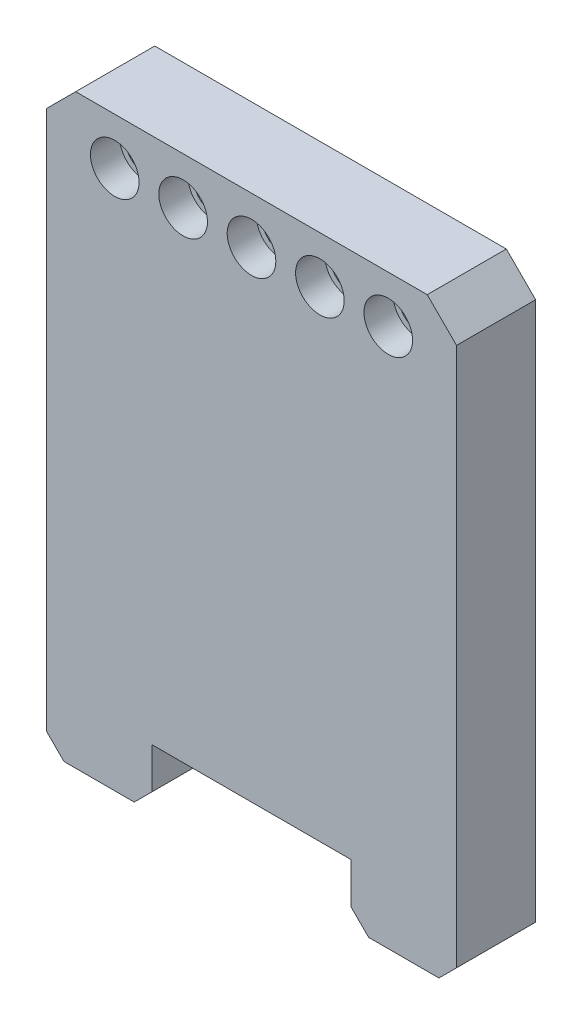
from build123d import *

# Parameters (mm, degrees)
SKETCH1_W           = 70
SKETCH1_H           = 13.5
BOSS_EXTRUDE1_DEPTH = 50
SKETCH2_W           = 34
SKETCH2_H           = 10
CUT_EXTRUDE1_DEPTH  = 100
SKETCH3_R           = 3.225
CUT_EXTRUDE2_DEPTH  = 3
CHAMFER1_SIZE       = 0.5
SKETCH4_R           = 4.15
CUT_EXTRUDE3_DEPTH  = 5
SKETCH5_R           = 3.15
CUT_EXTRUDE4_DEPTH  = 3
CHAMFER2_SIZE       = 3
CHAMFER3_SIZE       = 5


with BuildPart() as part:
    # Sketch1 → Boss-Extrude1 (new, symmetric)
    with BuildSketch(Plane(origin=(0, 0, 0), x_dir=(1, 0, 0), z_dir=(0, 1, 0))):
        Rectangle(SKETCH1_W, SKETCH1_H)
    extrude(amount=BOSS_EXTRUDE1_DEPTH, both=True)

    # Sketch2 → Cut-Extrude1 (cut)
    with BuildSketch(Plane.XY.offset(6.75)):
        with Locations((0, -45)):
            Rectangle(SKETCH2_W, SKETCH2_H)
    extrude(amount=-CUT_EXTRUDE1_DEPTH, mode=Mode.SUBTRACT)

    # Sketch3 → Cut-Extrude2 (cut)
    with BuildSketch(Plane.XZ.offset(40)):
        with Locations(Location((-10, 0, 0), (0, 0, 270))):
            Circle(SKETCH3_R)
        with Locations(Location((0, 0, 0), (0, 0, 270))):
            Circle(SKETCH3_R)
        with Locations(Location((10, 0, 0), (0, 0, 270))):
            Circle(SKETCH3_R)
    extrude(amount=-CUT_EXTRUDE2_DEPTH, mode=Mode.SUBTRACT)

    # Chamfer1
    chamfer1_edges = [part.edges().sort_by_distance(p)[0] for p in [
        (-10, -40, 3.225),
        (0, -40, 3.225),
        (10, -40, 3.225),
    ]]
    chamfer(chamfer1_edges, length=CHAMFER1_SIZE)

    # Sketch4 → Cut-Extrude3 (cut)
    with BuildSketch(Plane.XY.offset(6.75)):
        with Locations((-23.33, 42)):
            Circle(SKETCH4_R)
        with Locations((-11.66, 42)):
            Circle(SKETCH4_R)
        with Locations((0.01, 42)):
            Circle(SKETCH4_R)
        with Locations((11.68, 42)):
            Circle(SKETCH4_R)
        with Locations((23.35, 42)):
            Circle(SKETCH4_R)
    extrude(amount=-CUT_EXTRUDE3_DEPTH, mode=Mode.SUBTRACT)

    # Sketch5 → Cut-Extrude4 (cut)
    with BuildSketch(Plane.XY.offset(1.75)):
        with Locations((-23.33, 42)):
            Circle(SKETCH5_R)
        with Locations((-11.66, 42)):
            Circle(SKETCH5_R)
        with Locations((0.01, 42)):
            Circle(SKETCH5_R)
        with Locations((11.68, 42)):
            Circle(SKETCH5_R)
        with Locations((23.35, 42)):
            Circle(SKETCH5_R)
    extrude(amount=-CUT_EXTRUDE4_DEPTH, mode=Mode.SUBTRACT)

    # Chamfer2
    chamfer2_edges = [part.edges().sort_by_distance(p)[0] for p in [
        (17, -50, 0),
        (-17, -50, 0),
        (-35, -50, 0),
        (35, -50, 0),
    ]]
    chamfer(chamfer2_edges, length=CHAMFER2_SIZE)

    # Chamfer3
    chamfer3_edges = [part.edges().sort_by_distance(p)[0] for p in [
        (-35, 50, 0),
        (35, 50, 0),
    ]]
    chamfer(chamfer3_edges, length=CHAMFER3_SIZE)


solid = part.part
